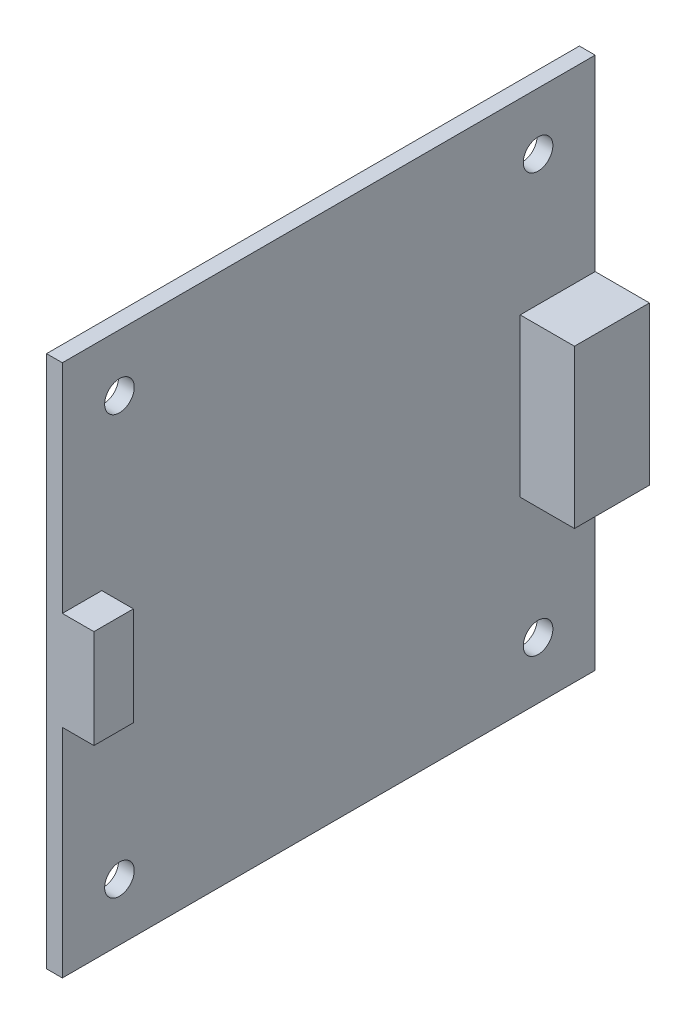
from build123d import *

# Parameters (mm, degrees)
SKETCH1_W           = 54
SKETCH1_H           = 54
BOSS_EXTRUDE1_DEPTH = 1.6
SKETCH2_R           = 1.5
CUT_EXTRUDE1_DEPTH  = 39.217273581
SKETCH3_W           = 4.2
SKETCH3_H           = 3.2
BOSS_EXTRUDE2_DEPTH = 1.2
SKETCH4_W           = 16
SKETCH4_H           = 7.6
BOSS_EXTRUDE3_DEPTH = 5.5
SKETCH5_W           = 10
SKETCH5_H           = 4
BOSS_EXTRUDE4_DEPTH = 3.2


with BuildPart() as part:
    # Sketch1 → Boss-Extrude1 (new body)
    with BuildSketch(Plane.YZ):
        Rectangle(SKETCH1_W, SKETCH1_H)
    extrude(amount=BOSS_EXTRUDE1_DEPTH)

    # Sketch2 → Cut-Extrude1 (cut, through all)
    with BuildSketch(Plane.YZ.offset(1.6)):
        with Locations(Location((-21.213203436, 21.213203436, 0), (0, 0, 270))):
            Circle(SKETCH2_R)
        with Locations(Location((21.213203436, 21.213203436, 0), (0, 0, 270))):
            Circle(SKETCH2_R)
        with Locations(Location((-21.213203436, -21.213203436, 0), (0, 0, 270))):
            Circle(SKETCH2_R)
        with Locations(Location((21.213203436, -21.213203436, 0), (0, 0, 270))):
            Circle(SKETCH2_R)
    extrude(amount=-CUT_EXTRUDE1_DEPTH, mode=Mode.SUBTRACT)

    # Sketch3 → Boss-Extrude2 (add)
    with BuildSketch(Plane(origin=(0, 0, 0), x_dir=(0, -1, 0), z_dir=(-1, 0, 0))):
        Rectangle(SKETCH3_W, SKETCH3_H)
    extrude(amount=BOSS_EXTRUDE2_DEPTH)

    # Sketch4 → Boss-Extrude3 (add)
    with BuildSketch(Plane.YZ.offset(1.6)):
        with Locations((0, -23.2)):
            Rectangle(SKETCH4_W, SKETCH4_H)
    extrude(amount=BOSS_EXTRUDE3_DEPTH)

    # Sketch5 → Boss-Extrude4 (add)
    with BuildSketch(Plane.YZ.offset(1.6)):
        with Locations((0, 25)):
            Rectangle(SKETCH5_W, SKETCH5_H)
    extrude(amount=BOSS_EXTRUDE4_DEPTH)


solid = part.part
